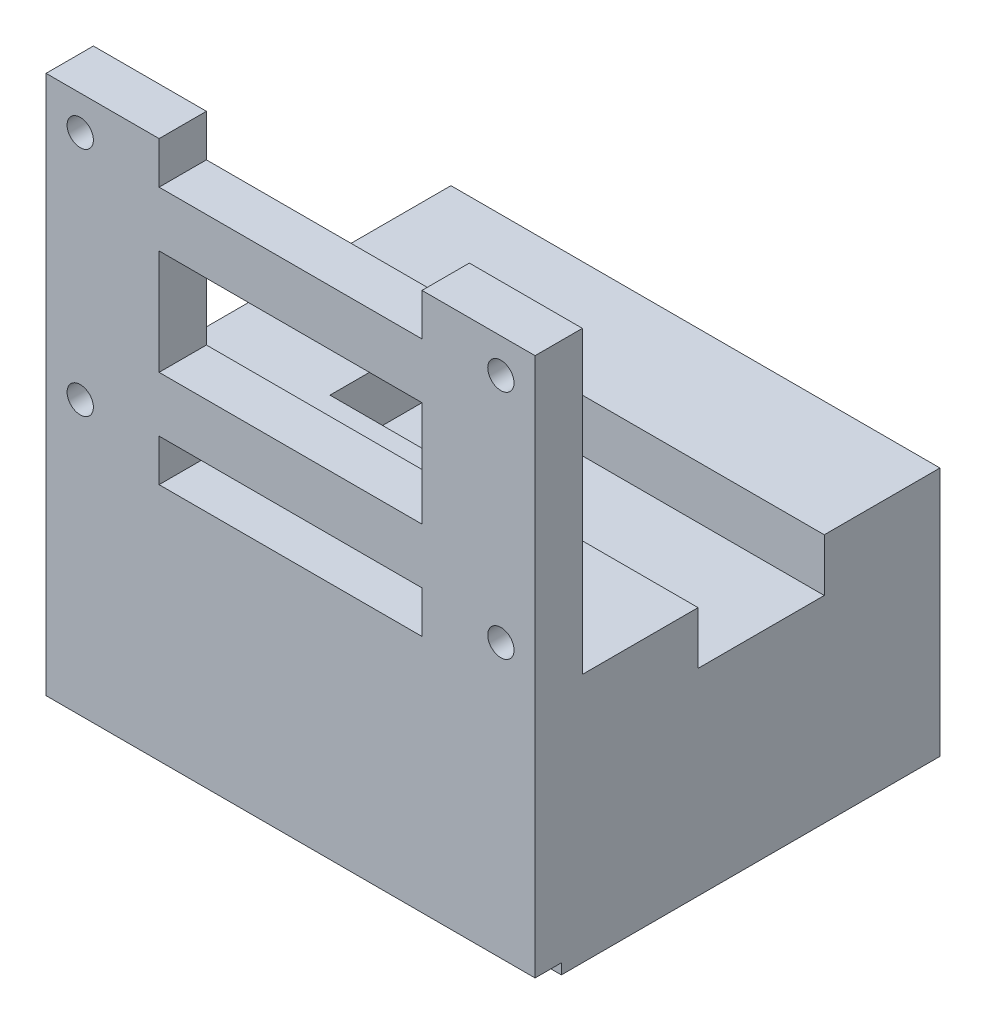
from build123d import *

# Parameters (mm, degrees)
SKETCH1_W                      = 46.5
SKETCH1_H                      = 34
BOSS_EXTRUDE1_DEPTH            = 13.75
SKETCH2_W                      = 46.5
SKETCH2_H                      = 42.25
BOSS_EXTRUDE2_DEPTH            = 2
SKETCH4_W                      = 35
SKETCH4_H                      = 12
CUT_EXTRUDE2_DEPTH             = 5
SKETCH6_W                      = 46.5
SKETCH6_H                      = 36
SKETCH6_R                      = 2
BOSS_EXTRUDE3_DEPTH            = 10
SKETCH8_W                      = 46.5
SKETCH8_H                      = 2.5
BOSS_EXTRUDE4_DEPTH            = 51.25
CUT_EXTRUDE1_REACH             = 62.18
SKETCH3_R                      = 1.25
SKETCH3_W                      = 25
SKETCH3_H                      = 10
CUT_EXTRUDE1_DIRECTION_2_DEPTH = 51
SKETCH7_W                      = 25
SKETCH7_H                      = 4
CUT_EXTRUDE3_DEPTH             = 10


with BuildPart() as part:
    # Sketch1 → Boss-Extrude1 (new body)
    with BuildSketch(Plane(origin=(0, 0, 0), x_dir=(1, 0, 0), z_dir=(0, 1, 0))):
        Rectangle(SKETCH1_W, SKETCH1_H)
    extrude(amount=BOSS_EXTRUDE1_DEPTH)

    # Sketch2 → Boss-Extrude2 (add)
    with BuildSketch(Plane.XY.offset(17)):
        with Locations((0, 21.125)):
            Rectangle(SKETCH2_W, SKETCH2_H)
    extrude(amount=BOSS_EXTRUDE2_DEPTH)

    # Sketch4 → Cut-Extrude2 (cut)
    with BuildSketch(Plane(origin=(0, 13.75, 0), x_dir=(1, 0, 0), z_dir=(0, 1, 0))):
        with Locations((5.75, 0)):
            Rectangle(SKETCH4_W, SKETCH4_H)
    extrude(amount=-CUT_EXTRUDE2_DEPTH, mode=Mode.SUBTRACT)

    # Sketch6 → Boss-Extrude3 (add)
    with BuildSketch(Plane.XZ):
        with Locations((0, 1)):
            Rectangle(SKETCH6_W, SKETCH6_H)
        with Locations(Location((16.25, -10, 0), (0, 0, 270))):
            Circle(SKETCH6_R, mode=Mode.SUBTRACT)
        with Locations(Location((-16.25, -10, 0), (0, 0, 270))):
            Circle(SKETCH6_R, mode=Mode.SUBTRACT)
        with Locations(Location((-16.25, 12, 0), (0, 0, 270))):
            Circle(SKETCH6_R, mode=Mode.SUBTRACT)
        with Locations(Location((16.25, 12, 0), (0, 0, 270))):
            Circle(SKETCH6_R, mode=Mode.SUBTRACT)
    extrude(amount=BOSS_EXTRUDE3_DEPTH)

    # Sketch8 → Boss-Extrude4 (add)
    with BuildSketch(Plane(origin=(0, -9, 0), x_dir=(-1, 0, 0), z_dir=(0, -1, 0))):
        with Locations((0, -20.25)):
            Rectangle(SKETCH8_W, SKETCH8_H)
    extrude(amount=-BOSS_EXTRUDE4_DEPTH)

    # Sketch3 → Cut-Extrude1 (cut, up to next)
    with BuildSketch(Plane.XY.offset(19), mode=Mode.PRIVATE) as cut_extrude1_sk1:
        with Locations(Location((-20, 39, 0), (0, 0, 180))):
            Circle(SKETCH3_R)
    cut_extrude1_tool1 = extrude(cut_extrude1_sk1.sketch, amount=-CUT_EXTRUDE1_REACH, mode=Mode.PRIVATE) & part.part
    # Sketch3 → Cut-Extrude1 (cut, up to next)
    with BuildSketch(Plane.XY.offset(19), mode=Mode.PRIVATE) as cut_extrude1_sk2:
        with Locations(Location((20, 39, 0), (0, 0, 180))):
            Circle(SKETCH3_R)
    cut_extrude1_tool2 = extrude(cut_extrude1_sk2.sketch, amount=-CUT_EXTRUDE1_REACH, mode=Mode.PRIVATE) & part.part
    # Sketch3 → Cut-Extrude1 (cut, up to next)
    with BuildSketch(Plane.XY.offset(19), mode=Mode.PRIVATE) as cut_extrude1_sk3:
        with Locations(Location((20, 17, 0), (0, 0, 180))):
            Circle(SKETCH3_R)
    cut_extrude1_tool3 = extrude(cut_extrude1_sk3.sketch, amount=-CUT_EXTRUDE1_REACH, mode=Mode.PRIVATE) & part.part
    # Sketch3 → Cut-Extrude1 (cut, up to next)
    with BuildSketch(Plane.XY.offset(19), mode=Mode.PRIVATE) as cut_extrude1_sk4:
        with Locations(Location((-20, 17, 0), (0, 0, 180))):
            Circle(SKETCH3_R)
    cut_extrude1_tool4 = extrude(cut_extrude1_sk4.sketch, amount=-CUT_EXTRUDE1_REACH, mode=Mode.PRIVATE) & part.part
    # Sketch3 → Cut-Extrude1 (cut, up to next)
    with BuildSketch(Plane.XY.offset(19), mode=Mode.PRIVATE) as cut_extrude1_sk5:
        with Locations((0, 28)):
            Rectangle(SKETCH3_W, SKETCH3_H)
    cut_extrude1_tool5 = extrude(cut_extrude1_sk5.sketch, amount=-CUT_EXTRUDE1_REACH, mode=Mode.PRIVATE) & part.part
    add(cut_extrude1_tool1.solids().sort_by_distance((-20, 39, 19))[0], mode=Mode.SUBTRACT)
    add(cut_extrude1_tool2.solids().sort_by_distance((20, 39, 19))[0], mode=Mode.SUBTRACT)
    add(cut_extrude1_tool3.solids().sort_by_distance((20, 17, 19))[0], mode=Mode.SUBTRACT)
    add(cut_extrude1_tool4.solids().sort_by_distance((-20, 17, 19))[0], mode=Mode.SUBTRACT)
    add(cut_extrude1_tool5.solids().sort_by_distance((0, 28, 19))[0], mode=Mode.SUBTRACT)

    # Sketch3 → Cut-Extrude1 direction 2 (cut)
    with BuildSketch(Plane.XY.offset(19)):
        with Locations(Location((-20, 39, 0), (0, 0, 180))):
            Circle(SKETCH3_R)
        with Locations(Location((20, 39, 0), (0, 0, 180))):
            Circle(SKETCH3_R)
        with Locations(Location((20, 17, 0), (0, 0, 180))):
            Circle(SKETCH3_R)
        with Locations(Location((-20, 17, 0), (0, 0, 180))):
            Circle(SKETCH3_R)
        with Locations((0, 28)):
            Rectangle(SKETCH3_W, SKETCH3_H)
    extrude(amount=CUT_EXTRUDE1_DIRECTION_2_DEPTH, mode=Mode.SUBTRACT)

    # Sketch7 → Cut-Extrude3 (cut)
    with BuildSketch(Plane(origin=(0, 0, 17), x_dir=(-1, 0, 0), z_dir=(0, 0, -1))):
        with Locations((0, 15.75)):
            Rectangle(SKETCH7_W, SKETCH7_H)
        with Locations((0, 40.25)):
            Rectangle(SKETCH7_W, SKETCH7_H)
    extrude(amount=-CUT_EXTRUDE3_DEPTH, mode=Mode.SUBTRACT)


solid = part.part
